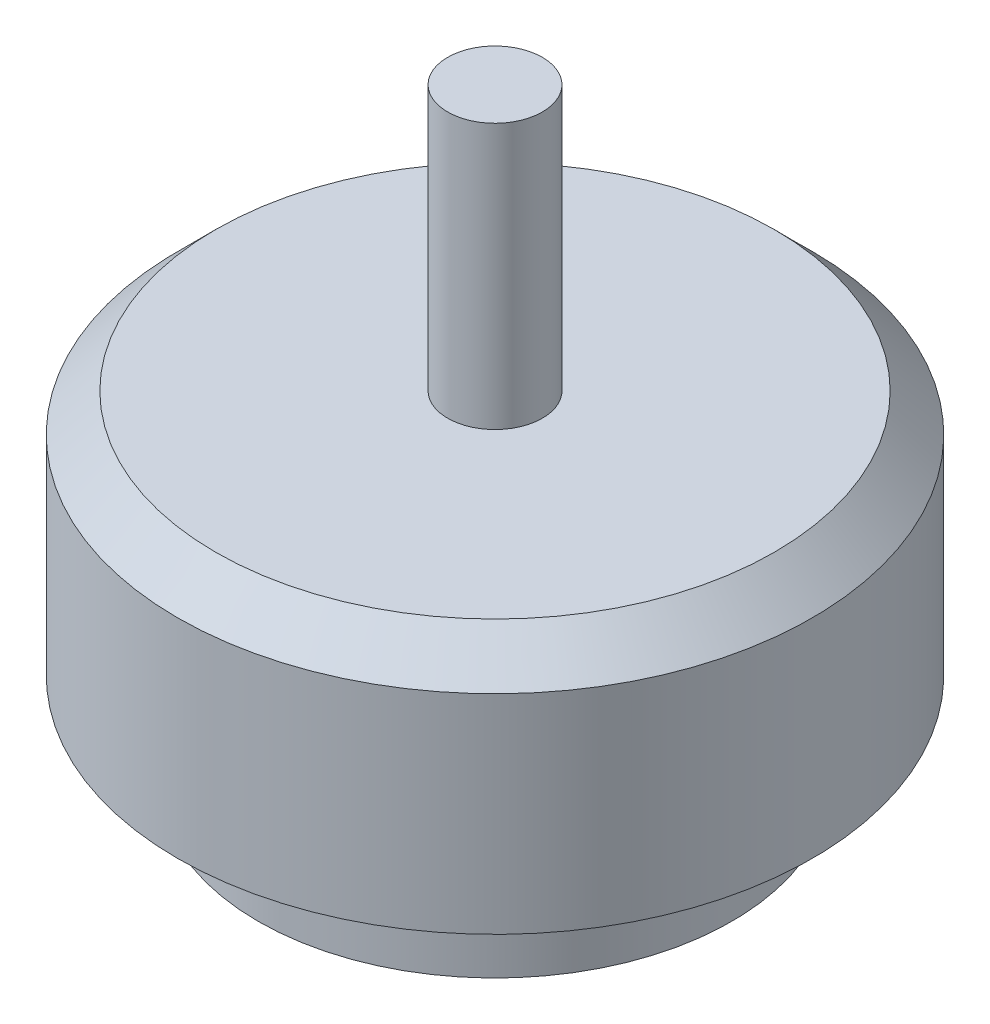
from build123d import *

# Parameters (mm, degrees)
CHAMFER1_SIZE = 2


with BuildPart() as part:
    # Sketch1 → Revolve1 (revolve)
    with BuildSketch(Plane.XY, mode=Mode.PRIVATE) as revolve1_sk:
        Polygon((0, 14), (2.5, 14), (2.5, 0), (16.75, 0), (16.75, -13), (5, -13), (5, -15), (12.5, -15), (12.5, -18), (0, -18), align=None)
    revolve(revolve1_sk.sketch.rotate(Axis((0, -18, 0), (0, 1, 0)), 90), axis=Axis((0, -18, 0), (0, 1, 0)))

    # Chamfer1
    chamfer1_edges = [part.edges().sort_by_distance(p)[0] for p in [
        (0, 0, 16.75),
    ]]
    chamfer(chamfer1_edges, length=CHAMFER1_SIZE)


solid = part.part
